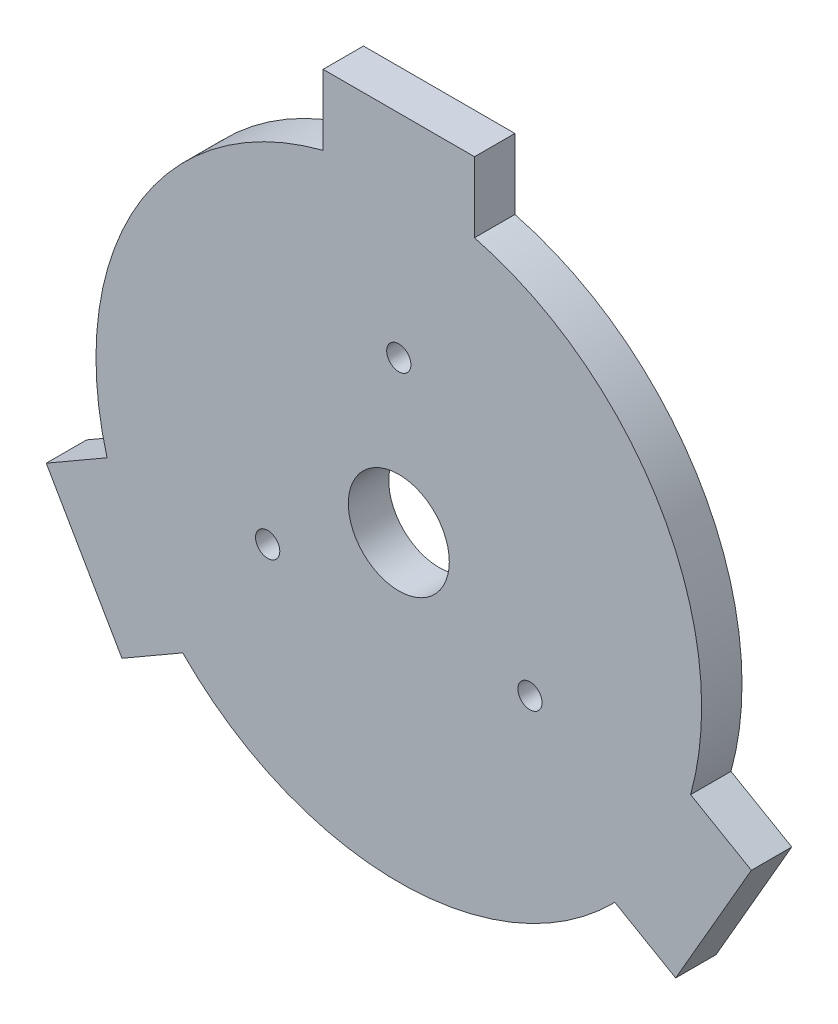
from build123d import *
from build123d.topology import SkipClean

# Parameters (mm, degrees)
SKETCH_1_R          = 5
EXTRUDE_1_DEPTH     = 4
CUT_EXTRUDE_1_DEPTH = 10
SKETCH_3_R          = 1.2
CUT_EXTRUDE_2_DEPTH = 5


with BuildPart() as part:
    # 草图1 → 凸台-拉伸1 (new body)
    with BuildSketch(Plane.XY):
        with BuildLine():
            Line((10, 28.284271247), (10, 36))
            Line((10, 36), (-10, 36))
            Line((-10, 36), (-10, 28.284271247))
            ThreePointArc((-10, 28.284271247), (-25.980762114, 15), (-29.494897428, -5.481881586))
            Line((-29.494897428, -5.481881586), (-36.176914536, -9.339745962))
            Line((-36.176914536, -9.339745962), (-26.176914536, -26.660254038))
            Line((-26.176914536, -26.660254038), (-19.494897428, -22.802389662))
            ThreePointArc((-19.494897428, -22.802389662), (0, -30), (19.494897428, -22.802389662))
            Line((19.494897428, -22.802389662), (26.176914536, -26.660254038))
            Line((26.176914536, -26.660254038), (36.176914536, -9.339745962))
            Line((36.176914536, -9.339745962), (29.494897428, -5.481881586))
            ThreePointArc((29.494897428, -5.481881586), (25.980762114, 15), (10, 28.284271247))
        make_face()
        Circle(SKETCH_1_R, mode=Mode.SUBTRACT)
    extrude(amount=EXTRUDE_1_DEPTH)

    # 草图2 → 切除-拉伸1 (cut)
    with SkipClean():  # the faces are left unmerged after this step: merging them gives an invalid solid
        with BuildSketch(Plane(origin=(0, 0, 0), x_dir=(-1, 0, 0), z_dir=(0, 0, -1))):
            with BuildLine():
                Line((-7.5, 29.047375097), (-7.5, 36))
                Line((-7.5, 36), (-10, 36))
                Line((-10, 36), (-10, 28.284271247))
                ThreePointArc((-10, 28.284271247), (-8.758315013, 28.693063938), (-7.5, 29.047375097))
            make_face()
            with BuildLine():
                Line((7.5, 36), (7.5, 29.047375097))
                ThreePointArc((7.5, 29.047375097), (8.758315013, 28.693063938), (10, 28.284271247))
                Line((10, 28.284271247), (10, 36))
                Line((10, 36), (7.5, 36))
            make_face()
            with BuildLine():
                Line((-34.926914536, -11.504809472), (-28.905764747, -8.02849702))
                ThreePointArc((-28.905764747, -8.02849702), (-29.228079789, -6.761608673), (-29.494897428, -5.481881586))
                Line((-29.494897428, -5.481881586), (-36.176914536, -9.339745962))
                Line((-36.176914536, -9.339745962), (-34.926914536, -11.504809472))
            make_face()
            with BuildLine():
                Line((-26.176914536, -26.660254038), (-27.426914536, -24.495190528))
                Line((-27.426914536, -24.495190528), (-21.405764747, -21.018878077))
                ThreePointArc((-21.405764747, -21.018878077), (-20.469764776, -21.931455265), (-19.494897428, -22.802389662))
                Line((-19.494897428, -22.802389662), (-26.176914536, -26.660254038))
            make_face()
            with BuildLine():
                Line((36.176914536, -9.339745962), (34.926914536, -11.504809472))
                Line((34.926914536, -11.504809472), (28.905764747, -8.02849702))
                ThreePointArc((28.905764747, -8.02849702), (29.228079789, -6.761608673), (29.494897428, -5.481881586))
                Line((29.494897428, -5.481881586), (36.176914536, -9.339745962))
            make_face()
            with BuildLine():
                Line((27.426914536, -24.495190528), (21.405764747, -21.018878077))
                ThreePointArc((21.405764747, -21.018878077), (20.469764776, -21.931455265), (19.494897428, -22.802389662))
                Line((19.494897428, -22.802389662), (26.176914536, -26.660254038))
                Line((26.176914536, -26.660254038), (27.426914536, -24.495190528))
            make_face()
        extrude(amount=-CUT_EXTRUDE_1_DEPTH, mode=Mode.SUBTRACT)

    # 草图3 → 切除-拉伸2 (cut, symmetric)
    with SkipClean():  # the faces are left unmerged after this step: merging them gives an invalid solid
        with BuildSketch(Plane(origin=(0, 0, 0), x_dir=(-1, 0, 0), z_dir=(0, 0, -1))):
            with Locations(Location((0, 15, 0), (0, 0, 180))):
                Circle(SKETCH_3_R)
            with Locations(Location((12.990381057, -7.5, 0), (0, 0, 180))):
                Circle(SKETCH_3_R)
            with Locations(Location((-12.990381057, -7.5, 0), (0, 0, 180))):
                Circle(SKETCH_3_R)
        extrude(amount=CUT_EXTRUDE_2_DEPTH, both=True, mode=Mode.SUBTRACT)


solid = part.part
